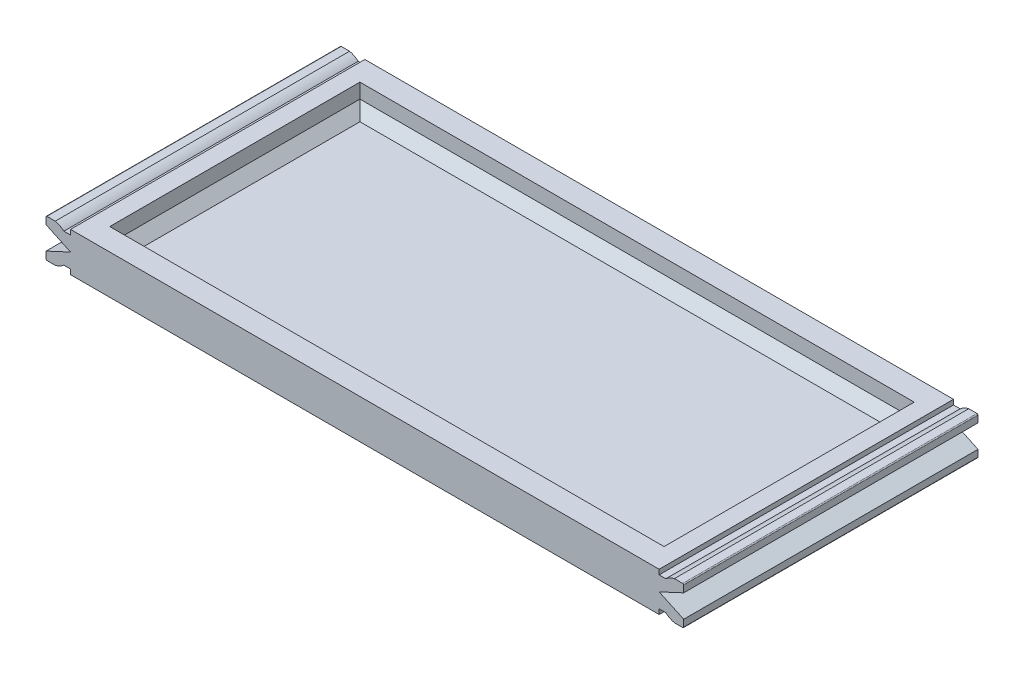
from build123d import *

# Parameters (mm, degrees)
EXTRUDE_1_DEPTH       = 2
EXTRUDE_1_DEPTH_BACK  = 2
SKETCH_1_W            = 60
SKETCH_1_H            = 30
SKETCH_2_W            = 56.5
SKETCH_2_H            = 25.5
CUT_EXTRUDE_1_DEPTH   = 2.5
CHAMFER_1_SIZE        = 1
EXTRUDE_2_DEPTH       = 15
MIRROR_2_COPY_1_DEPTH = 15
FILLET_1_R            = 0.1


with BuildPart() as part:
    # 草图1 → 凸台-拉伸1 (new, two sides: drawn at the far end of the back side and taken through both)
    with BuildSketch(Plane(origin=(0, 0, 0), x_dir=(1, 0, 0), z_dir=(0, 1, 0)).offset(-EXTRUDE_1_DEPTH_BACK)):
        Rectangle(SKETCH_1_W, SKETCH_1_H)
    extrude(amount=EXTRUDE_1_DEPTH + EXTRUDE_1_DEPTH_BACK)

    # 草图2 → 切除-拉伸1 (cut)
    with BuildSketch(Plane(origin=(0, 2, 0), x_dir=(1, 0, 0), z_dir=(0, 1, 0))):
        Rectangle(SKETCH_2_W, SKETCH_2_H)
    extrude(amount=-CUT_EXTRUDE_1_DEPTH, mode=Mode.SUBTRACT)

    # 倒角1
    chamfer_1_edges = [part.edges().sort_by_distance(p)[0] for p in [
        (28.25, -0.5, 0),
        (0, -0.5, 12.75),
        (-28.25, -0.5, 0),
        (0, -0.5, -12.75),
    ]]
    chamfer(chamfer_1_edges, length=CHAMFER_1_SIZE)

    # 草图3 → 凸台-拉伸2 (add, symmetric)
    with BuildSketch(Plane.XY):
        with BuildLine():
            Line((30.677124344, 1.5), (30, 1.5))
            Line((30, 1.5), (30, 0))
            Line((30, 0), (32.5, 1.165769145))
            Line((32.5, 1.165769145), (32.5, 1.95))
            Line((32.5, 1.95), (31.555590279, 1.95))
            ThreePointArc((31.555590279, 1.95), (31.088161527, 1.780042303), (30.677124344, 1.5))
        make_face()
    extrude_2 = extrude(amount=EXTRUDE_2_DEPTH, both=True)

    # 镜向1: 凸台-拉伸2 across plane
    add(extrude_2.mirror(Plane.ZX))

    # 镜向2: 凸台-拉伸2 across plane
    add(extrude_2.mirror(Plane(origin=(0, 0, 0), x_dir=(0, 0, 1), z_dir=(1, 0, 0))))

    # 镜向2 copy 1 sketch → 镜向2 copy 1 (add, symmetric)
    with BuildSketch(Plane(origin=(0, 0, 0), x_dir=(-1, 0, 0), z_dir=(0, 0, 1))):
        with BuildLine():
            Line((30.677124344, 1.5), (30, 1.5))
            Line((30, 1.5), (30, 0))
            Line((30, 0), (32.5, 1.165769145))
            Line((32.5, 1.165769145), (32.5, 1.95))
            Line((32.5, 1.95), (31.555590279, 1.95))
            ThreePointArc((31.555590279, 1.95), (31.088161527, 1.780042303), (30.677124344, 1.5))
        make_face()
    extrude(amount=MIRROR_2_COPY_1_DEPTH, both=True)

    # 圆角1
    fillet_1_edges = [part.edges().sort_by_distance(p)[0] for p in [
        (32.5, -1.95, 0),
        (32.5, 1.95, 0),
        (-32.5, -1.95, 0),
        (-32.5, 1.95, 0),
    ]]
    fillet(fillet_1_edges, radius=FILLET_1_R)


solid = part.part
